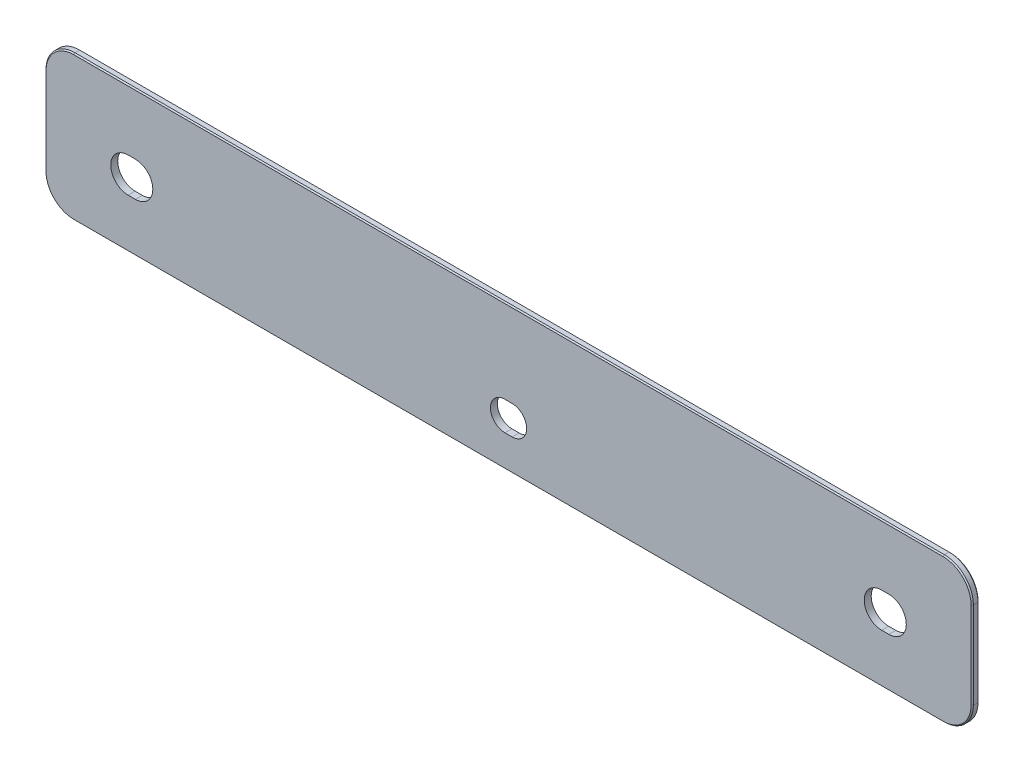
from build123d import *

# Parameters (mm, degrees)
SKETCH1_W           = 50
SKETCH1_H           = 320
BOSS_EXTRUDE1_DEPTH = 2.4
FILLET1_R           = 10
CHAMFER1_SIZE       = 0.4


with BuildPart() as part:
    # Sketch1 → Boss-Extrude1 (new body)
    with BuildSketch(Plane(origin=(0, 0, 0), x_dir=(0, 1, 0), z_dir=(0, 0, 1))):
        with Locations((2, 0)):
            Rectangle(SKETCH1_W, SKETCH1_H)
        with BuildLine():
            Line((-6, 128.75), (-6, 131.25))
            ThreePointArc((-6, 131.25), (0, 137.25), (6, 131.25))
            Line((6, 131.25), (6, 128.75))
            ThreePointArc((6, 128.75), (0, 122.75), (-6, 128.75))
        make_face(mode=Mode.SUBTRACT)
        with BuildLine():
            Line((-6, -131.25), (-6, -128.75))
            ThreePointArc((-6, -128.75), (0, -122.75), (6, -128.75))
            Line((6, -128.75), (6, -131.25))
            ThreePointArc((6, -131.25), (0, -137.25), (-6, -131.25))
        make_face(mode=Mode.SUBTRACT)
        with BuildLine():
            Line((-2, 1.25), (-2, -1.25))
            ThreePointArc((-2, -1.25), (-7, -6.25), (-12, -1.25))
            Line((-12, -1.25), (-12, 1.25))
            ThreePointArc((-12, 1.25), (-7, 6.25), (-2, 1.25))
        make_face(mode=Mode.SUBTRACT)
    extrude(amount=BOSS_EXTRUDE1_DEPTH)

    # Fillet1
    fillet1_edges = [part.edges().sort_by_distance(p)[0] for p in [
        (160, 27, 1.2),
        (160, -23, 1.2),
        (-160, -23, 1.2),
        (-160, 27, 1.2),
    ]]
    fillet(fillet1_edges, radius=FILLET1_R)

    # Chamfer1
    chamfer1_edges = [part.edges().sort_by_distance(p)[0] for p in [
        (0, 27, 0),
        (0, 27, 2.4),
        (160, 2, 0),
        (0, -23, 0),
        (-160, 2, 0),
        (157.071067812, -20.071067812, 0),
        (-157.071067812, -20.071067812, 0),
        (-157.071067812, 24.071067812, 0),
        (157.071067812, 24.071067812, 0),
        (160, 2, 2.4),
        (-160, 2, 2.4),
        (0, -23, 2.4),
        (157.071067812, -20.071067812, 2.4),
        (-157.071067812, -20.071067812, 2.4),
        (-157.071067812, 24.071067812, 2.4),
        (157.071067812, 24.071067812, 2.4),
    ]]
    chamfer(chamfer1_edges, length=CHAMFER1_SIZE)


solid = part.part
